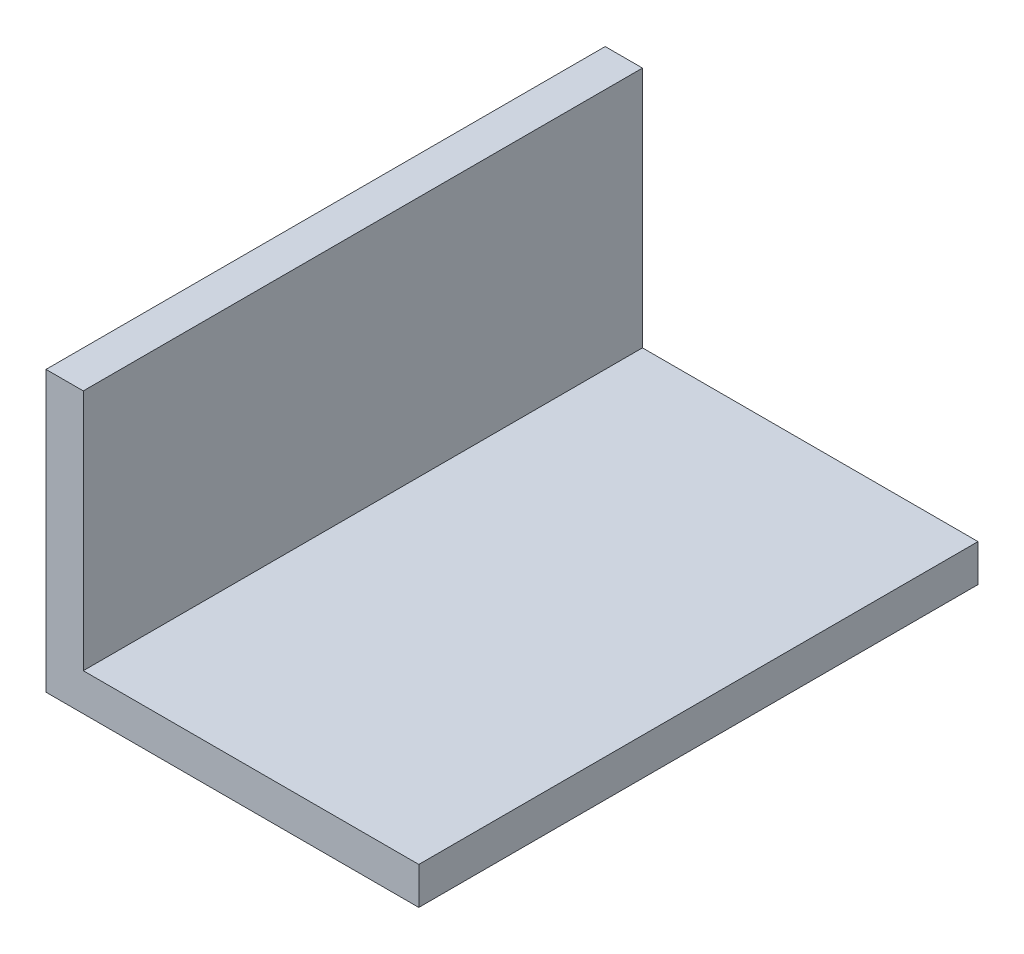
from build123d import *

# Parameters (mm, degrees)
SKETCH_1_W          = 30
SKETCH_1_H          = 15
EXTRUDE_1_DEPTH     = 20
SKETCH_2_W          = 18
SKETCH_2_H          = 13
CUT_EXTRUDE_1_DEPTH = 52.419840529
SCALE_1_SCALE       = 1.7


with BuildPart() as part:
    # 草图1 → 凸台-拉伸1 (new body)
    with BuildSketch(Plane(origin=(40, 0, 0), x_dir=(0, 0, -1), z_dir=(1, 0, 0))):
        with Locations((-35, 4.5)):
            Rectangle(SKETCH_1_W, SKETCH_1_H)
    extrude(amount=-EXTRUDE_1_DEPTH)

    # 草图2 → 切除-拉伸1 (cut, through all)
    with BuildSketch(Plane.XY.offset(50)):
        with Locations((31, 5.5)):
            Rectangle(SKETCH_2_W, SKETCH_2_H)
    extrude(amount=-CUT_EXTRUDE_1_DEPTH, mode=Mode.SUBTRACT)


with BuildPart() as part_1:
    # 缩放比例1: scaled about (0, 0, 0)
    add(part.part.scale(SCALE_1_SCALE))


solid = part_1.part
